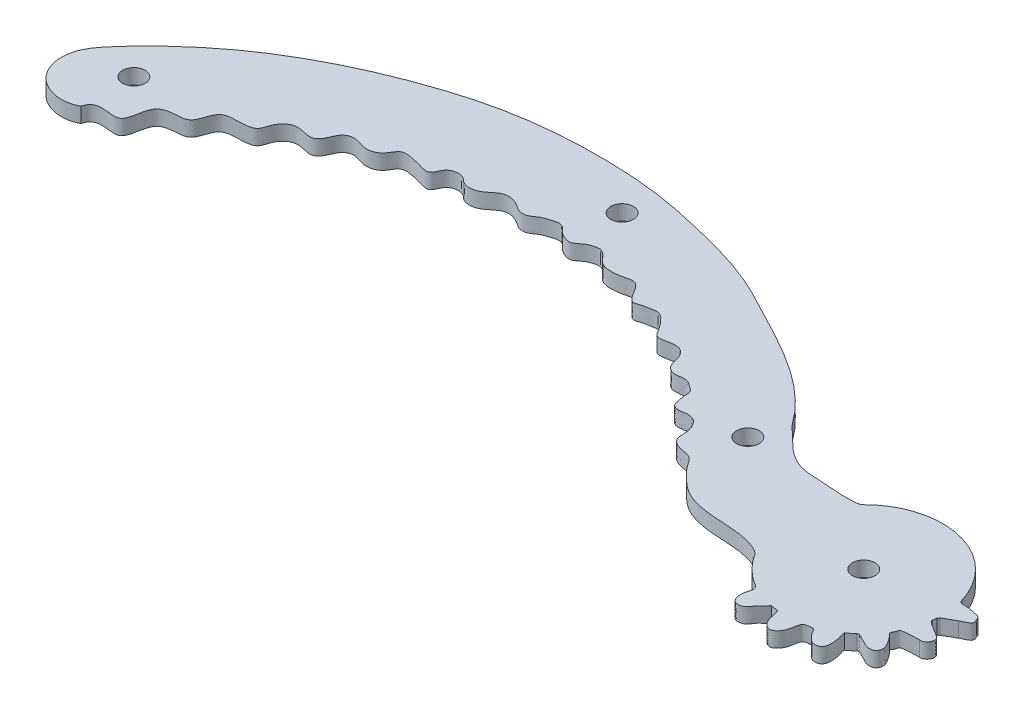
from build123d import *

# Parameters (mm, degrees)
SKETCH_1_R      = 1.5
EXTRUDE_1_DEPTH = 2


with BuildPart() as part:
    # 草图1 → 凸台-拉伸1 (new body)
    with BuildSketch(Plane(origin=(0, 0, 0), x_dir=(1, 0, 0), z_dir=(0, 1, 0))):
        with BuildLine():
            Line((10.227183647, 3.488788505), (10.290717603, 3.299662996))
            add(Edge.make_bspline(
                [(10.290717603, 3.299662996), (10.301338914, 3.275480746), (10.457818126, 2.989266375), (11.547223073, 3.07546841), (12.375473658, 2.834788373), (13.310157698, 2.674756162), (13.45462097, 2.138499572), (13.762876416, 1.548688953), (12.994386963, 1.155642889), (12.575893619, 0.939893422), (12.387437485, 0.854252789)],
                knots=[0.147270796, 0.147270796, 0.147270796, 0.147270796, 0.148943743, 0.168524793, 0.193946417, 0.20665723, 0.215311131, 0.224119599, 0.240105168, 0.252370277, 0.252370277, 0.252370277, 0.252370277], degree=3))
            Line((12.387437485, 0.854252789), (10.816925741, -0.043763429))
            add(Edge.make_bspline(
                [(10.816925741, -0.043763429), (10.793962383, -0.062127935), (10.724046987, -0.123558558), (10.667758964, -0.203093291), (10.636462955, -0.262602415)],
                knots=[0, 0, 0, 0, 0.001679859, 0.005303532, 0.005303532, 0.005303532, 0.005303532], degree=3))
            ThreePointArc((10.636462955, -0.262602415), (10.610281074, -0.564708063), (10.575386266, -0.865931678))
            add(Edge.make_bspline(
                [(10.575386266, -0.865931678), (10.577375526, -0.871704132), (10.654592566, -1.084447869), (11.326620603, -1.568554967), (12.185700777, -1.98138669), (13.458613749, -2.947454494), (12.559041732, -4.043955507), (12.014187133, -3.923680805)],
                knots=[0.016513034, 0.016513034, 0.016513034, 0.016513034, 0.016861446, 0.029457327, 0.059740724, 0.076900083, 0.107821813, 0.107821813, 0.107821813, 0.107821813], degree=3))
            add(Edge.make_bspline(
                [(12.014187133, -3.923680805), (11.300076476, -3.905350468), (10.655222884, -3.978278201), (9.465148323, -4.095115332), (9.47554962, -4.68002163), (9.06400231, -5.103825612), (9.640259421, -5.525655318), (9.991680975, -6.060870311), (10.432510753, -6.68194385), (10.673027897, -7.406014285), (10.388640434, -8.112746374), (9.412731932, -8.396226154), (8.526207414, -7.823268836), (7.785487758, -7.522568689), (7.346945643, -7.259809377), (7.199217259, -7.315164181), (7.139378616, -7.355069276)],
                knots=[0, 0, 0, 0, 0.026895041, 0.034085431, 0.042799758, 0.04715316, 0.055528116, 0.06464447, 0.076427103, 0.086731366, 0.095387649, 0.105065668, 0.124845371, 0.136056498, 0.140621617, 0.143899568, 0.143899568, 0.143899568, 0.143899568], degree=3))
            ThreePointArc((7.139378616, -7.355069276), (6.680698129, -7.73993225), (6.200825797, -8.098024198))
            add(Edge.make_bspline(
                [(-0.848865333, -9.958234372), (-0.632641288, -10.217962291), (-0.511066066, -10.941342328), (-0.302971257, -12.053418788), (0.902794935, -12.996334298), (1.952525336, -11.934184288), (2.149316639, -10.921490697), (2.328942608, -9.701846799), (3.11604044, -9.738772661), (3.753820562, -9.575020559), (3.995077237, -10.281561743), (4.536460309, -10.756857106), (5.099002721, -11.513193283), (6.348665707, -11.416427139), (6.622527471, -10.415752599), (6.521220282, -9.604030958), (6.442867488, -8.887266052), (6.124827698, -8.276208915), (6.200825797, -8.098024198)],
                knots=[0.637936758, 0.637936758, 0.637936758, 0.637936758, 0.65076311, 0.668889993, 0.685366138, 0.701511805, 0.71875472, 0.73297241, 0.74288652, 0.748199785, 0.757993847, 0.767232555, 0.779863379, 0.795449066, 0.807138678, 0.81859081, 0.829540719, 0.839847967, 0.839847967, 0.839847967, 0.839847967], degree=3))
            ThreePointArc((-0.848865333, -9.958234372), (-1.323470648, -9.901321425), (-1.794993908, -9.822866959))
            add(Edge.make_bspline(
                [(-5.118681012, -8.581679135), (-5.038030144, -8.653339013), (-4.714010071, -9.020890691), (-5.078961924, -9.939718694), (-5.155884043, -10.913655846), (-4.717891672, -12.068658289), (-3.301247232, -11.856448742), (-2.811378442, -10.747334251), (-2.142963074, -10.339131666), (-1.831628414, -9.87311674), (-1.794993908, -9.822866959)],
                knots=[0.523720711, 0.523720711, 0.523720711, 0.523720711, 0.528247924, 0.545423341, 0.55711902, 0.571395296, 0.589105263, 0.601142621, 0.619943519, 0.622383948, 0.622383948, 0.622383948, 0.622383948], degree=3))
            ThreePointArc((-5.118681012, -8.581679135), (-7.195906552, -6.996266732), (-8.817312191, -4.947012676))
            add(Edge.make_bspline(
                [(-35.663023794, 10.700141345), (-34.94312987, 10.038986812), (-33.518995547, 10.925833593), (-32.472365363, 9.92675466), (-31.709509799, 9.52162033), (-31.696401942, 8.467557397), (-31.538566623, 7.62366728), (-31.314970649, 6.688232564), (-30.312901427, 6.364112377), (-29.359611993, 6.775118479), (-28.237292534, 6.406683001), (-27.578770295, 5.49625708), (-27.288462376, 4.366397137), (-27.406462315, 3.248336955), (-26.728123042, 2.49086971), (-25.702672021, 2.087213777), (-24.147740715, 2.044171504), (-23.50814825, 0.650543623), (-22.321524606, -0.520024153), (-21.1435731, -1.813666705), (-18.726969113, -3.110754399), (-15.227380628, -3.557071775), (-11.654497645, -3.539568558), (-9.361890986, -4.483496585), (-8.817312191, -4.947012676)],
                knots=[0, 0, 0, 0, 0.036097754, 0.047992692, 0.058181774, 0.069734768, 0.087708592, 0.096698401, 0.107023851, 0.126400839, 0.138602891, 0.153227265, 0.171393147, 0.187122158, 0.197485969, 0.211171774, 0.233173167, 0.256561051, 0.268556148, 0.303731538, 0.328871743, 0.381864229, 0.448811497, 0.479780929, 0.479780929, 0.479780929, 0.479780929], degree=3))
            add(Edge.make_bspline(
                [(-47.406633283, 17.723349838), (-47.054262019, 17.500687635), (-46.346020955, 15.417760795), (-44.965110142, 16.144266591), (-44.083587165, 16.232883591), (-43.205559076, 16.510747881), (-42.383384313, 16.134617593), (-41.712380984, 15.388217963), (-41.036927374, 14.613030066), (-40.413341816, 13.2874651), (-38.86232086, 13.706351062), (-37.40275584, 13.865498164), (-36.196961705, 12.467747852), (-36.365818024, 11.227082172), (-35.663023794, 10.700141345)],
                knots=[0, 0, 0, 0, 0.161236225, 0.212348344, 0.265446348, 0.336192936, 0.378687986, 0.430636784, 0.526782428, 0.58317029, 0.682556587, 0.781270878, 0.853713789, 1, 1, 1, 1], degree=3))
            add(Edge.make_bspline(
                [(-71.211015786, 18.722756027), (-70.565023186, 18.018310927), (-68.635207655, 18.07560327), (-67.417986196, 19.704020005), (-65.896731708, 19.888662428), (-64.833492712, 19.425326943), (-63.904092676, 18.689038352), (-62.739273803, 18.72359405), (-61.917411105, 19.507463533), (-60.800136097, 19.856679076), (-59.456026134, 20.295324185), (-58.665740944, 19.213535743), (-57.805126962, 18.715220804), (-56.72620899, 18.444404662), (-55.979625185, 19.290144471), (-55.051942148, 19.674577173), (-53.99222981, 19.950816695), (-53.040589916, 19.129066901), (-52.260872716, 18.048694742), (-50.771050759, 17.909233555), (-49.173879365, 18.113153533), (-47.925642795, 18.611389728), (-47.406633283, 17.723349838)],
                knots=[0, 0, 0, 0, 0.101433113, 0.182304189, 0.213922123, 0.268056796, 0.309965909, 0.34593792, 0.389140378, 0.432998877, 0.482664358, 0.529097115, 0.56671955, 0.598853252, 0.644172777, 0.680167064, 0.715860802, 0.759457234, 0.81099574, 0.863337515, 0.916048189, 1, 1, 1, 1], degree=3))
            add(Edge.make_bspline(
                [(-105.038188782, 1.766377716), (-104.540855548, 3.904020539), (-99.919356226, 1.073446661), (-100.689899543, 6.683034055), (-97.995568756, 7.110507897), (-95.615590252, 7.135622523), (-95.509923919, 10.649576217), (-92.689456812, 10.38841404), (-90.475029289, 10.694480287), (-90.289347971, 12.679137442), (-88.724182671, 13.984123879), (-87.20035829, 13.548852968), (-85.976672167, 13.351043708), (-84.979725862, 14.316771144), (-84.796563555, 15.620805421), (-83.279156424, 16.515232605), (-82.015768769, 15.820708154), (-80.591980908, 15.776486739), (-79.332036558, 16.412295156), (-78.820611066, 18.018915213), (-77.081336876, 17.819731182), (-75.896220153, 17.540591655), (-74.080404318, 16.930762161), (-73.664058048, 19.231518493), (-71.83117553, 19.283783973), (-71.211015786, 18.722756027)],
                knots=[0, 0, 0, 0, 0.100331873, 0.186040252, 0.234954161, 0.270300487, 0.337741822, 0.40191981, 0.438279808, 0.476829941, 0.523229195, 0.559516768, 0.58417291, 0.604077361, 0.648703103, 0.670042471, 0.715950186, 0.738312734, 0.768610762, 0.808997733, 0.834826144, 0.87587524, 0.906400305, 0.9417144, 1, 1, 1, 1], degree=3))
            add(Edge.make_bspline(
                [(-21.134476435, 12.280890365), (-24.86453391, 17.51025742), (-32.167884001, 21.24106989), (-42.140633334, 26.56392235), (-49.048836823, 28.402991894), (-55.807157961, 29.882770351), (-61.952233466, 30.452131191), (-69.532741511, 30.455619887), (-77.076571557, 29.439073136), (-83.887922984, 27.377199081), (-91.412503551, 24.518212731), (-100.540102293, 19.607865984), (-107.725899874, 13.213761002), (-111.967840012, 8.222454738), (-112.042344632, 5.018304804), (-110.391963961, 1.582946793), (-106.992357259, 0.708171462), (-105.038188782, 1.766377716)],
                knots=[0, 0, 0, 0, 0.162308773, 0.214040795, 0.297345888, 0.349154488, 0.396314503, 0.459530434, 0.548645129, 0.595484357, 0.646703325, 0.76081959, 0.864658636, 0.902713076, 0.926128156, 0.944546812, 1, 1, 1, 1], degree=3))
            add(Edge.make_bspline(
                [(-7.44231465, 7.731542483), (-7.862763485, 7.604591339), (-9.54806768, 7.48001041), (-12.33801299, 7.808267568), (-17.161612571, 7.760533441), (-19.654840885, 10.96357838), (-21.134476435, 12.280890365)],
                knots=[0.711171768, 0.711171768, 0.711171768, 0.711171768, 0.736619646, 0.803221292, 0.875531472, 1, 1, 1, 1], degree=3))
            ThreePointArc((-7.44231465, 7.731542483), (2.615222752, 10.702625504), (10.227183647, 3.488788505))
        make_face()
        with Locations(Location((0.163673424, 0.492830898, 0), (0, 0, 270))):
            Circle(SKETCH_1_R, mode=Mode.SUBTRACT)
        with Locations(Location((-22.712970828, 7.981488376, 0), (0, 0, 270))):
            Circle(SKETCH_1_R, mode=Mode.SUBTRACT)
        with Locations(Location((-56.850795931, 25.41985454, 0), (0, 0, 270))):
            Circle(SKETCH_1_R, mode=Mode.SUBTRACT)
        with Locations(Location((-104.909707995, 8.658897353, 0), (0, 0, 270))):
            Circle(SKETCH_1_R, mode=Mode.SUBTRACT)
    extrude(amount=EXTRUDE_1_DEPTH)


solid = part.part
